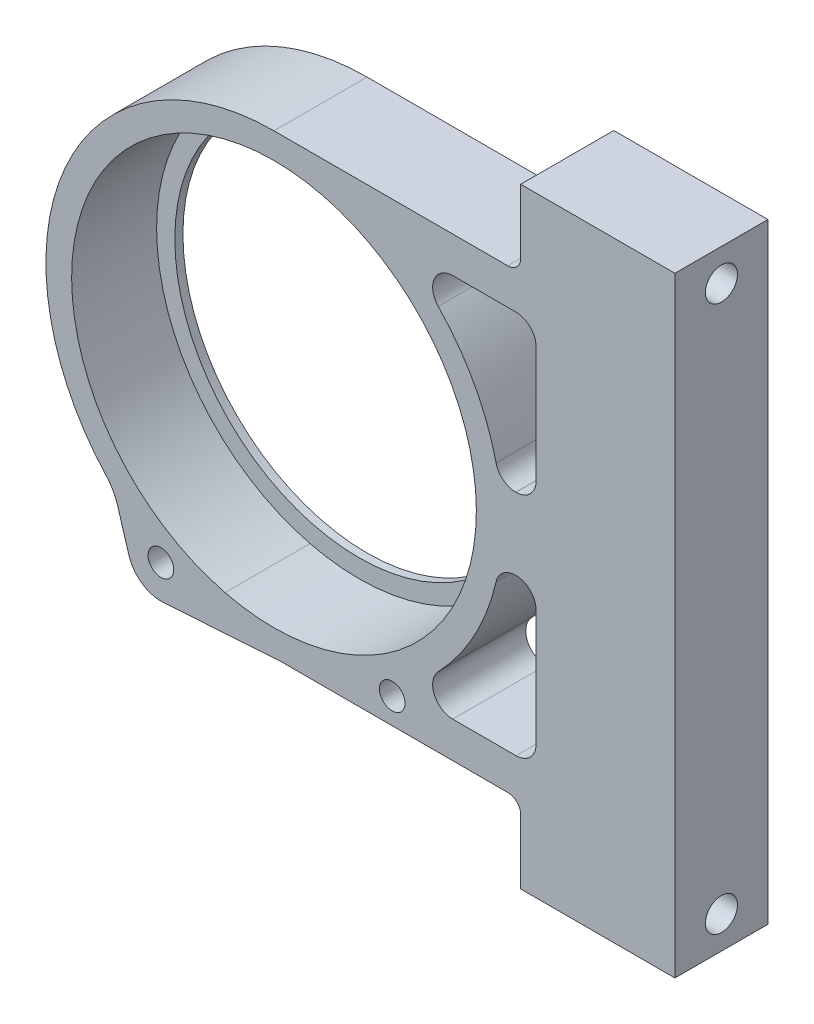
from build123d import *

# Parameters (mm, degrees)
SKETCH1_R           = 50
BOSS_EXTRUDE1_DEPTH = 23
SKETCH2_R           = 3.96875
CUT_EXTRUDE1_DEPTH  = 23
BOSS_EXTRUDE2_START = -2
SKETCH3_R           = 50
SKETCH3_R_2         = 45.5
BOSS_EXTRUDE2_DEPTH = 2
CUT_EXTRUDE2_DEPTH  = 108.888625907
FILLET1_R           = 4.953
SKETCH6_R           = 3.175
CUT_EXTRUDE4_DEPTH  = 30.48
BOSS_EXTRUDE4_DEPTH = 23
FILLET2_R           = 12.7
SKETCH9_W           = 23
SKETCH9_H           = 150.8
SKETCH9_R           = 3.96875
BOSS_EXTRUDE5_DEPTH = 25.4


with BuildPart() as part:
    # Sketch1 → Boss-Extrude1 (new body)
    with BuildSketch(Plane.XY):
        with BuildLine():
            Line((73.66, 75.4), (73.66, -75.4))
            Line((73.66, -75.4), (60.96, -75.4))
            Line((60.96, -75.4), (60.96, -59.525))
            ThreePointArc((60.96, -59.525), (60.03006403, -57.27993597), (57.785, -56.35))
            Line((57.785, -56.35), (0, -56.35))
            ThreePointArc((0, -56.35), (-56.35, 0), (0, 56.35))
            Line((0, 56.35), (57.785, 56.35))
            ThreePointArc((57.785, 56.35), (60.03006403, 57.27993597), (60.96, 59.525))
            Line((60.96, 59.525), (60.96, 75.4))
            Line((60.96, 75.4), (73.66, 75.4))
        make_face()
        Circle(SKETCH1_R, mode=Mode.SUBTRACT)
    extrude(amount=-BOSS_EXTRUDE1_DEPTH)

    # Sketch2 → Cut-Extrude1 (cut)
    with BuildSketch(Plane.ZY.offset(-60.96)):
        with Locations((-11.5, 67.4625)):
            Circle(SKETCH2_R)
        with Locations((-11.5, -67.4625)):
            Circle(SKETCH2_R)
    extrude(amount=-CUT_EXTRUDE1_DEPTH, mode=Mode.SUBTRACT)

    # Sketch3 → Boss-Extrude2 (add)
    with BuildSketch(Plane(origin=(0, 0, -23), x_dir=(-1, 0, 0), z_dir=(0, 0, -1)).offset(BOSS_EXTRUDE2_START)):
        with Locations(Location((0, 0, 0), (0, 0, 180))):
            Circle(SKETCH3_R)
        Circle(SKETCH3_R_2, mode=Mode.SUBTRACT)
    extrude(amount=BOSS_EXTRUDE2_DEPTH)

    # Sketch4 → Cut-Extrude2 (cut, through all)
    with BuildSketch(Plane.XY):
        with BuildLine():
            Line((64.77, 8.89), (64.77, 47.46))
            Line((64.77, 47.46), (30.355226425, 47.46))
            ThreePointArc((30.355226425, 47.46), (47.120470693, 30.879647228), (55.631459367, 8.89))
            Line((55.631459367, 8.89), (64.77, 8.89))
        make_face()
        with BuildLine():
            Line((30.355226425, -47.46), (64.77, -47.46))
            Line((64.77, -47.46), (64.77, -8.89))
            Line((64.77, -8.89), (55.631459367, -8.89))
            ThreePointArc((55.631459367, -8.89), (47.120470693, -30.879647228), (30.355226425, -47.46))
        make_face()
    extrude(amount=-CUT_EXTRUDE2_DEPTH, mode=Mode.SUBTRACT)

    # Fillet1
    fillet1_edges = [part.edges().sort_by_distance(p)[0] for p in [
        (30.355226425, -47.46, -11.5),
        (55.631459367, -8.89, -11.5),
        (64.77, -8.89, -11.5),
        (64.77, -47.46, -11.5),
        (55.631459367, 8.89, -11.5),
        (30.355226425, 47.46, -11.5),
        (64.77, 47.46, -11.5),
        (64.77, 8.89, -11.5),
    ]]
    fillet(fillet1_edges, radius=FILLET1_R)

    # Sketch6 → Cut-Extrude4 (cut)
    with BuildSketch(Plane.XY):
        with Locations((-27.94, -50)):
            Circle(SKETCH6_R)
        with Locations((29.21, -50)):
            Circle(SKETCH6_R)
    extrude(amount=-CUT_EXTRUDE4_DEPTH, mode=Mode.SUBTRACT)

    # Sketch8 → Boss-Extrude4 (add)
    with BuildSketch(Plane.XY):
        with BuildLine():
            Line((-39.555189909, -40.133644879), (-35.840291724, -52.393828665))
            ThreePointArc((-35.840291724, -52.393828665), (-32.642189928, -56.784868082), (-27.407882123, -58.23783197))
            Line((-27.407882123, -58.23783197), (3.632324942, -56.232808177))
            ThreePointArc((3.632324942, -56.232808177), (-10.963276805, -55.273221922), (-24.82017584, -50.58934049))
            ThreePointArc((-24.82017584, -50.58934049), (-29.488783115, -52.771623326), (-30.076991341, -47.651831989))
            ThreePointArc((-30.076991341, -47.651831989), (-35.018437298, -44.147837424), (-39.555189909, -40.133644879))
        make_face()
    extrude(amount=-BOSS_EXTRUDE4_DEPTH)

    # Fillet2
    fillet2_edges = [part.edges().sort_by_distance(p)[0] for p in [
        (-39.555189909, -40.133644879, -11.5),
    ]]
    fillet(fillet2_edges, radius=FILLET2_R)

    # Sketch9 → Boss-Extrude5 (add)
    with BuildSketch(Plane(origin=(73.66, 0, 0), x_dir=(0, 0, -1), z_dir=(1, 0, 0))):
        with Locations((11.5, 0)):
            Rectangle(SKETCH9_W, SKETCH9_H)
        with Locations(Location((11.5, 67.4625, 0), (0, 0, 180))):
            Circle(SKETCH9_R, mode=Mode.SUBTRACT)
        with Locations(Location((11.5, -67.4625, 0), (0, 0, 180))):
            Circle(SKETCH9_R, mode=Mode.SUBTRACT)
    extrude(amount=BOSS_EXTRUDE5_DEPTH)


solid = part.part
